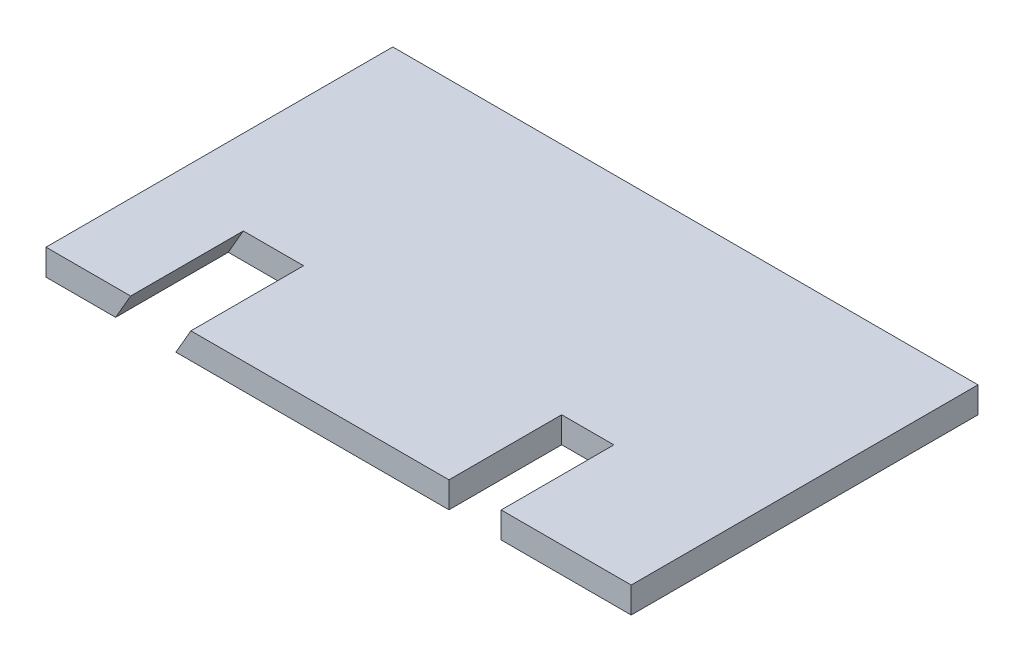
from build123d import *

# Parameters (mm, degrees)
SKETCH1_W           = 135
SKETCH1_H           = 6
BOSS_EXTRUDE1_DEPTH = 80
SKETCH2_W           = 12.04
SKETCH2_H           = 6
CUT_EXTRUDE1_DEPTH  = 26


with BuildPart() as part:
    # Sketch1 → Boss-Extrude1 (new body)
    with BuildSketch(Plane.XY):
        Rectangle(SKETCH1_W, SKETCH1_H)
    extrude(amount=BOSS_EXTRUDE1_DEPTH)

    # Sketch2 → Cut-Extrude1 (cut)
    with BuildSketch(Plane.XY.offset(80)):
        with Locations((31.48, 0)):
            Rectangle(SKETCH2_W, SKETCH2_H)
        Polygon((-34.075898385, 3), (-37.54, -3), (-51.442594482, -3), (-47.978492867, 3), align=None)
    extrude(amount=-CUT_EXTRUDE1_DEPTH, mode=Mode.SUBTRACT)


solid = part.part
